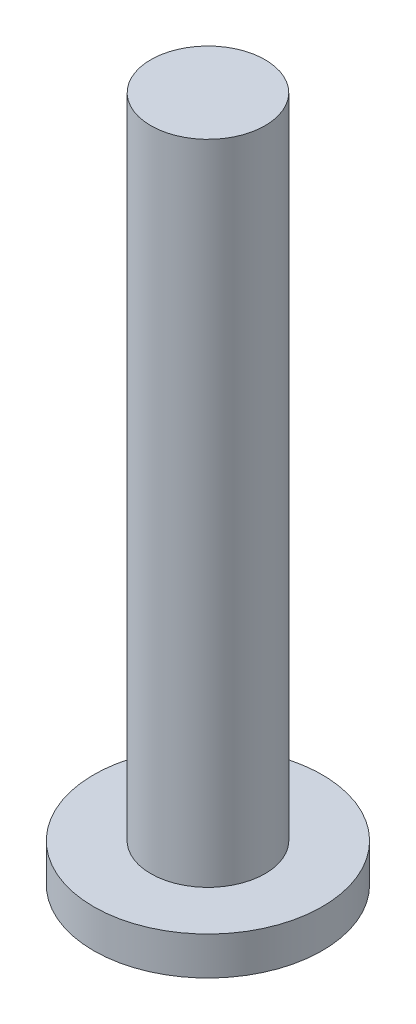
from build123d import *

# Parameters (mm, degrees)
SKETCH_1_R      = 30
EXTRUDE_1_DEPTH = 10
SKETCH_2_R      = 15
EXTRUDE_2_DEPTH = 170


with BuildPart() as part:
    # Эскиз1 → Бобышка-Вытянуть1 (new body)
    with BuildSketch(Plane(origin=(0, 0, 0), x_dir=(1, 0, 0), z_dir=(0, 1, 0))):
        with Locations(Location((0, 0, 0), (0, 0, 270))):
            Circle(SKETCH_1_R)
    extrude(amount=EXTRUDE_1_DEPTH)

    # Эскиз2 → Бобышка-Вытянуть2 (add)
    with BuildSketch(Plane(origin=(0, 10, 0), x_dir=(1, 0, 0), z_dir=(0, 1, 0))):
        with Locations(Location((0, 0, 0), (0, 0, 270))):
            Circle(SKETCH_2_R)
    extrude(amount=EXTRUDE_2_DEPTH)


solid = part.part
